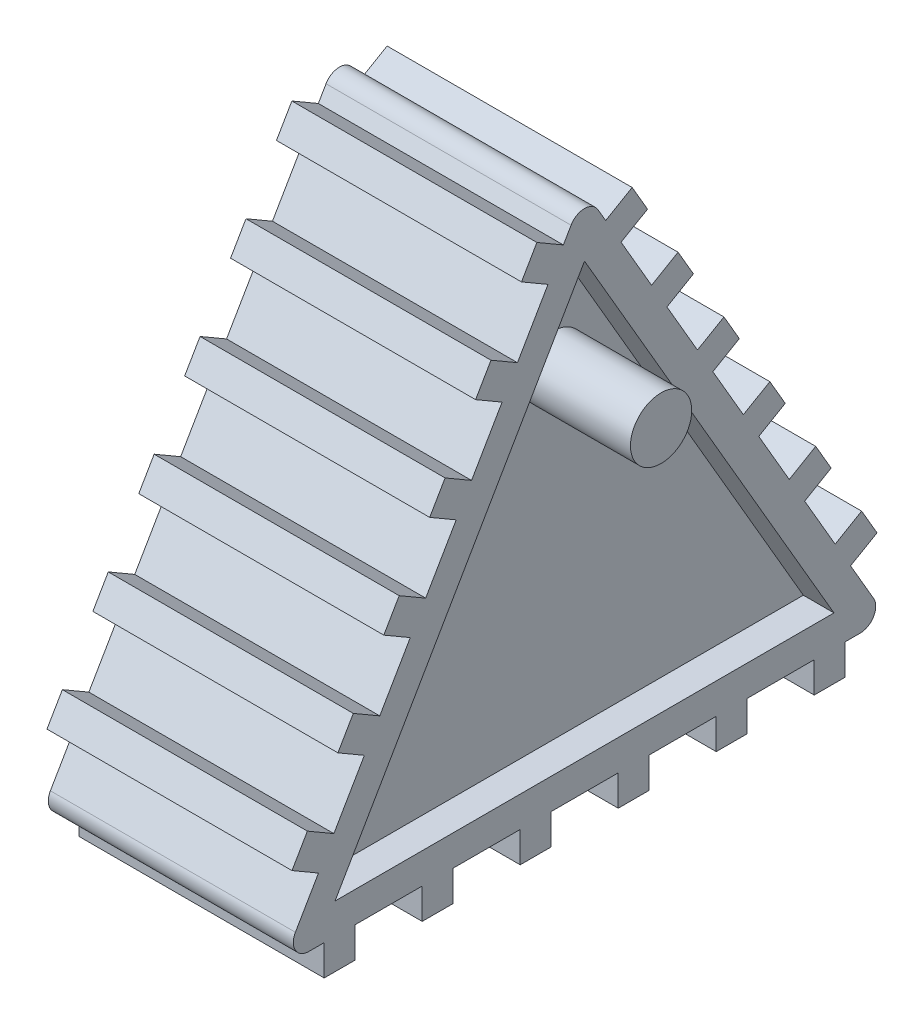
from build123d import *

# Parameters (mm, degrees)
BOSS_EXTRUDE2_DEPTH      = 40
SHELL8_T                 = -5
SHELL8_THICKNESS_2_DEPTH = 30
SHELL9_T                 = -5
SHELL9_THICKNESS_2_DEPTH = 25
SKETCH2_R                = 5
BOSS_EXTRUDE3_DEPTH      = 17.5
SKETCH5_W                = 40
SKETCH5_H                = 5
BOSS_EXTRUDE4_DEPTH      = 5
LPATTERN4_COUNT          = 6
LPATTERN4_PITCH          = 14.916530468
SKETCH10_W               = 40
SKETCH10_H               = 5
BOSS_EXTRUDE5_DEPTH      = 5
LPATTERN5_COUNT          = 6
LPATTERN5_PITCH          = 14.916530468
SKETCH11_W               = 40
SKETCH11_H               = 5
BOSS_EXTRUDE6_DEPTH      = 5
LPATTERN8_COUNT          = 6
LPATTERN8_PITCH          = 16


with BuildPart() as part:
    # Sketch1 → Boss-Extrude2 (new body)
    with BuildSketch(Plane(origin=(0, 0, 0), x_dir=(0, 0, -1), z_dir=(1, 0, 0))):
        with BuildLine():
            Line((-23.925257966, -38.695147184), (21.074742034, 38.764852816))
            ThreePointArc((21.074742034, 38.764852816), (23.271019939, 40.02893614), (25.467297844, 38.764852816))
            Line((25.467297844, 38.764852816), (70.467297844, -38.695147184))
            ThreePointArc((70.467297844, -38.695147184), (70.4724318, -41.238102068), (68.271019939, -42.51106386))
            Line((68.271019939, -42.51106386), (-21.728980061, -42.51106386))
            ThreePointArc((-21.728980061, -42.51106386), (-23.930391921, -41.238102068), (-23.925257966, -38.695147184))
        make_face()
    extrude(amount=BOSS_EXTRUDE2_DEPTH)

    # Shell8
    shell8_openings = [part.faces().sort_by_distance(p)[0] for p in [
        (40, -14.15791791, -23.271019939),
    ]]
    offset(amount=SHELL8_T, openings=shell8_openings, kind=Kind.INTERSECTION)

    # Shell8 thickness 2 face (on inner face of the shell) → Shell8 thickness 2 (add)
    with BuildSketch(Plane(origin=(5, -14.143458858, -23.271019939), x_dir=(0, 0, -1), z_dir=(-1, 0, 0))):
        Polygon((0, -46.735210004), (-40.725880135, 23.367605002), (40.725880135, 23.367605002), align=None)
    extrude(amount=-SHELL8_THICKNESS_2_DEPTH)

    # Shell9
    shell9_openings = [part.faces().sort_by_distance(p)[0] for p in [
        (0, -14.15791791, -23.271019939),
    ]]
    offset(amount=SHELL9_T, openings=shell9_openings, kind=Kind.INTERSECTION)

    # Shell9 thickness 2 face (on inner face of the shell) → Shell9 thickness 2 (add)
    with BuildSketch(Plane(origin=(30, -14.143458858, -23.271019939), x_dir=(0, 0, 1), z_dir=(1, 0, 0))):
        Polygon((-40.725880135, 23.367605002), (40.725880135, 23.367605002), (0, -46.735210004), align=None)
    extrude(amount=-SHELL9_THICKNESS_2_DEPTH)

    # Sketch2 → Boss-Extrude3 (add)
    with BuildSketch(Plane(origin=(35, 0, 0), x_dir=(0, 0, -1), z_dir=(1, 0, 0))):
        with Locations(Location((23.271019939, 15.225073428, 0), (0, 0, 180))):
            Circle(SKETCH2_R)
    extrude(amount=BOSS_EXTRUDE3_DEPTH)

    # Sketch5 → Boss-Extrude4 (add)
    with BuildSketch(Plane(origin=(0, 20.843502994, -35.878616486), x_dir=(-1, 0, 0), z_dir=(0, 0.5023294000044014, -0.864676340540909))):
        with Locations((-20, 15.726078629)):
            Rectangle(SKETCH5_W, SKETCH5_H)
    boss_extrude4 = extrude(amount=BOSS_EXTRUDE4_DEPTH)

    # LPattern4: Boss-Extrude4 ×6
    with Locations(*[Vector(0, -0.8646763405409094, -0.5023294000044011) * (i * LPATTERN4_PITCH) for i in range(1, LPATTERN4_COUNT)]):
        add(boss_extrude4)

    # Sketch10 → Boss-Extrude5 (add)
    with BuildSketch(Plane(origin=(0, 0.627858722, 1.080754147), x_dir=(1, 0, 0), z_dir=(0, 0.5023294000044011, 0.8646763405409094))):
        with Locations((20, 39.105513596)):
            Rectangle(SKETCH10_W, SKETCH10_H)
    boss_extrude5 = extrude(amount=BOSS_EXTRUDE5_DEPTH)

    # LPattern5: Boss-Extrude5 ×6
    with Locations(*[Vector(0, -0.8646763405409092, 0.5023294000044013) * (i * LPATTERN5_PITCH) for i in range(1, LPATTERN5_COUNT)]):
        add(boss_extrude5)

    # Sketch11 → Boss-Extrude6 (add)
    with BuildSketch(Plane.XZ.offset(42.51106386)):
        with Locations((20, 16.728980061)):
            Rectangle(SKETCH11_W, SKETCH11_H)
    boss_extrude6 = extrude(amount=BOSS_EXTRUDE6_DEPTH)

    # LPattern8: Boss-Extrude6 ×6
    with Locations(*[(0, 0, -i * LPATTERN8_PITCH) for i in range(1, LPATTERN8_COUNT)]):
        add(boss_extrude6)


solid = part.part
